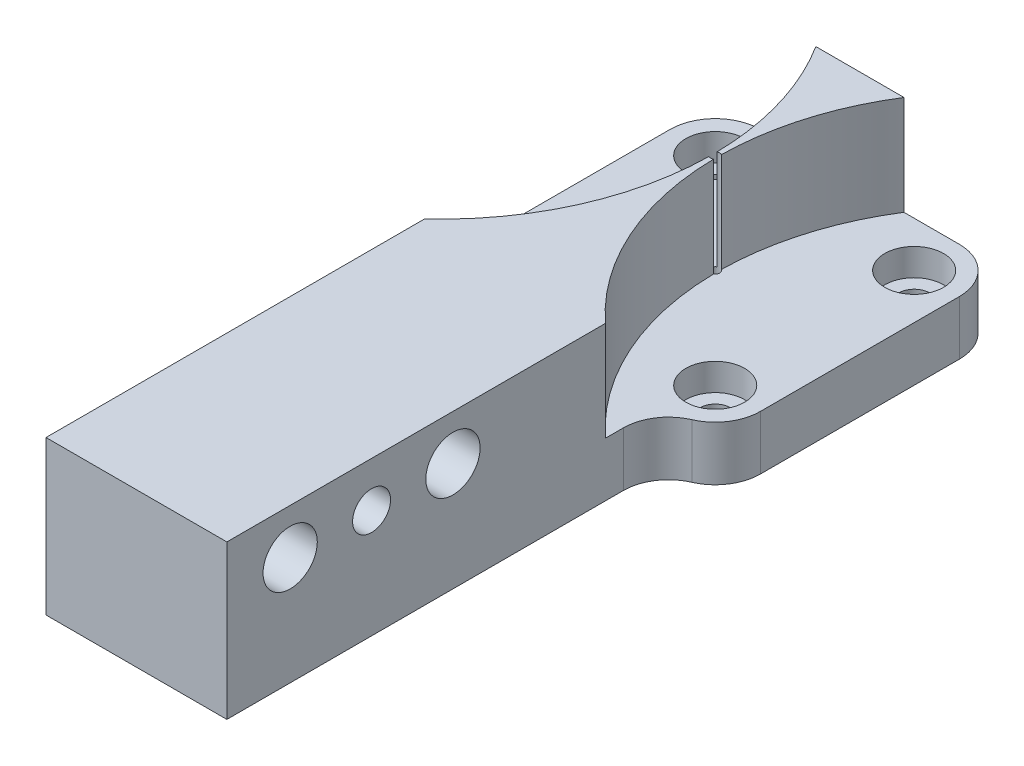
from build123d import *

# Parameters (mm, degrees)
SKETCH1_W                      = 32.5
SKETCH1_H                      = 80.25
BOSS_EXTRUDE1_DEPTH            = 6
BOSS_EXTRUDE2_DEPTH            = 11
F_6_0MM_DOWEL_HOLE1_D          = 6
M5X0_8_TAPPED_HOLE1_D          = 4.2
CBORE_FOR_M3_SHCS1_D           = 3.4
CBORE_FOR_M3_SHCS1_CBORE_D     = 6.5
CBORE_FOR_M3_SHCS1_CBORE_DEPTH = 3
F_1_0_1_DIAMETER_HOLE1_D       = 1
SKETCH12_R                     = 1.5
CUT_EXTRUDE1_DEPTH             = 5
SKETCH13_W                     = 6
SKETCH13_H                     = 35
CUT_EXTRUDE2_DEPTH             = 84.624906577
FILLET1_R                      = 2.38125
SKETCH14_W                     = 34.5
SKETCH14_H                     = 82.25
CUT_EXTRUDE3_DEPTH             = 84.624906577


with BuildPart() as part:
    # Sketch1 → Boss-Extrude1 (new body)
    with BuildSketch(Plane(origin=(0, 0, 0), x_dir=(1, 0, 0), z_dir=(0, 1, 0))):
        with Locations((0, -40.125)):
            Rectangle(SKETCH1_W, SKETCH1_H)
    extrude(amount=-BOSS_EXTRUDE1_DEPTH)

    # Sketch2 → Boss-Extrude2 (add)
    with BuildSketch(Plane(origin=(0, 0, 0), x_dir=(1, 0, 0), z_dir=(0, 1, 0))):
        with BuildLine():
            Line((-5.032198748, 0), (5.032198748, 0))
            ThreePointArc((5.032198748, 0), (1.230950737, -23.858861929), (16.25, -42.782998323))
            Line((16.25, -42.782998323), (16.25, -80.25))
            Line((16.25, -80.25), (-16.25, -80.25))
            Line((-16.25, -80.25), (-16.25, -42.782998323))
            ThreePointArc((-16.25, -42.782998323), (-1.230950737, -23.858861929), (-5.032198748, 0))
        make_face()
    extrude(amount=BOSS_EXTRUDE2_DEPTH)

    # Ø6.0mm Dowel Hole1 (through all)
    with Locations(Plane(origin=(16.25, 0, 0), x_dir=(0, 0, -1), z_dir=(1, 0, 0))):
        with Locations((-73.25, 6), (-55.25, 6)):
            Hole(F_6_0MM_DOWEL_HOLE1_D / 2)

    # M5x0.8 Tapped Hole1 (through all)
    with Locations(Plane(origin=(16.25, 0, 0), x_dir=(0, 0, -1), z_dir=(1, 0, 0))):
        with Locations((-64.25, 6)):
            Hole(M5X0_8_TAPPED_HOLE1_D / 2)

    # CBORE for M3 SHCS1 (through all)
    with Locations(Plane(origin=(0, 0, 0), x_dir=(1, 0, 0), z_dir=(0, 1, 0))):
        with Locations((-11, -5.25), (11, -5.25), (11, -27.25), (-11, -27.25)):
            CounterBoreHole(CBORE_FOR_M3_SHCS1_D / 2, CBORE_FOR_M3_SHCS1_CBORE_D / 2, CBORE_FOR_M3_SHCS1_CBORE_DEPTH)

    # Ø1.0 (1) Diameter Hole1 (through all)
    with Locations(Plane(origin=(0, 11, 0), x_dir=(1, 0, 0), z_dir=(0, 1, 0))):
        with Locations((0, -16.25)):
            Hole(F_1_0_1_DIAMETER_HOLE1_D / 2)

    # Sketch12 → Cut-Extrude1 (cut)
    with BuildSketch(Plane.XZ.offset(6)):
        with Locations(Location((0, 16.25, 0), (0, 0, 270))):
            Circle(SKETCH12_R)
    extrude(amount=-CUT_EXTRUDE1_DEPTH, mode=Mode.SUBTRACT)

    # Sketch13 → Cut-Extrude2 (cut, through all)
    with BuildSketch(Plane(origin=(0, 11, 0), x_dir=(1, 0, 0), z_dir=(0, 1, 0))):
        with Locations((-13.25, -62.75)):
            Rectangle(SKETCH13_W, SKETCH13_H)
        with Locations((13.25, -62.75)):
            Rectangle(SKETCH13_W, SKETCH13_H)
    extrude(amount=-CUT_EXTRUDE2_DEPTH, mode=Mode.SUBTRACT)

    # Fillet1
    fillet1_edges = [part.edges().sort_by_distance(p)[0] for p in [
        (-10.25, 2.5, 45.25),
        (10.25, 2.5, 45.25),
    ]]
    fillet(fillet1_edges, radius=FILLET1_R)

    # Sketch14 → Cut-Extrude3 (cut, through all)
    with BuildSketch(Plane(origin=(0, 11, 0), x_dir=(1, 0, 0), z_dir=(0, 1, 0))):
        with Locations((0, -40.125)):
            Rectangle(SKETCH14_W, SKETCH14_H)
        with BuildLine():
            Line((-10, -80.25), (-10, -36.41515139))
            ThreePointArc((-10, -36.41515139), (-10.816699867, -33.676538602), (-13, -31.832575695))
            ThreePointArc((-13, -31.832575695), (-15.183300133, -29.988612788), (-16, -27.25))
            Line((-16, -27.25), (-16, -5.25))
            ThreePointArc((-16, -5.25), (-14.535533906, -1.714466094), (-11, -0.25))
            Line((-11, -0.25), (11, -0.25))
            ThreePointArc((11, -0.25), (14.535533906, -1.714466094), (16, -5.25))
            Line((16, -5.25), (16, -27.25))
            ThreePointArc((16, -27.25), (15.183300133, -29.988612788), (13, -31.832575695))
            ThreePointArc((13, -31.832575695), (10.816699867, -33.676538602), (10, -36.41515139))
            Line((10, -36.41515139), (10, -80.25))
            Line((10, -80.25), (-10, -80.25))
        make_face(mode=Mode.SUBTRACT)
    extrude(amount=-CUT_EXTRUDE3_DEPTH, mode=Mode.SUBTRACT)


solid = part.part
